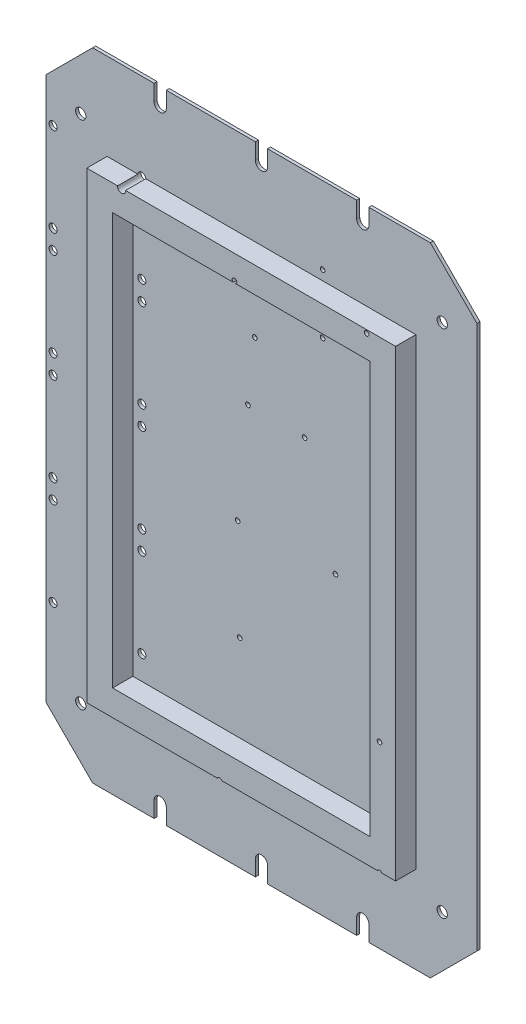
from build123d import *

# Parameters (mm, degrees)
BOSS_EXTRUDE1_DEPTH      = 0.75
BOSS_EXTRUDE1_DEPTH_BACK = 0.75
CUT_EXTRUDE1_DEPTH       = 190.772483022
LPATTERN1_COUNT          = 7
LPATTERN1_PITCH          = 50
MIRROR1_COPY_1_DEPTH     = 190.772483022
MIRROR1_COPY_2_DEPTH     = 190.772483022
MIRROR1_COPY_3_DEPTH     = 190.772483022
MIRROR1_COPY_4_DEPTH     = 190.772483022
MIRROR1_COPY_5_DEPTH     = 190.772483022
MIRROR1_COPY_6_DEPTH     = 190.772483022
SKETCH6_W                = 152.4
SKETCH6_H                = 228.6
SKETCH6_W_2              = 127
SKETCH6_H_2              = 203.2
BOSS_EXTRUDE2_DEPTH      = 11.5
SKETCH7_R                = 2.54
CUT_EXTRUDE2_DEPTH       = 191.11912795
CUT_EXTRUDE3_DEPTH       = 191.11912795
CUT_EXTRUDE3_DEPTH_BACK  = 191.11912795
SKETCH8_R                = 1.15
CUT_EXTRUDE4_DEPTH       = 191.11912795


with BuildPart() as part:
    # Sketch3 → Boss-Extrude1 (new, two sides: drawn at the far end of the back side and taken through both)
    with BuildSketch(Plane.XY.offset(-BOSS_EXTRUDE1_DEPTH_BACK)):
        Polygon((-106.3625, 134.1625), (-83.3625, 157.1625), (83.3625, 157.1625), (106.3625, 134.1625), (106.3625, -134.1625), (83.3625, -157.1625), (-83.3625, -157.1625), (-106.3625, -134.1625), align=None)
    extrude(amount=BOSS_EXTRUDE1_DEPTH + BOSS_EXTRUDE1_DEPTH_BACK)

    # Sketch4 → Cut-Extrude1 (cut, symmetric)
    with BuildSketch(Plane.XY):
        with BuildLine():
            Line((53, 149.225), (53, 157.1625))
            Line((53, 157.1625), (47, 157.1625))
            Line((47, 157.1625), (47, 149.225))
            ThreePointArc((47, 149.225), (50, 146.225), (53, 149.225))
        make_face()
    cut_extrude1 = extrude(amount=CUT_EXTRUDE1_DEPTH, both=True, mode=Mode.SUBTRACT)

    # LPattern1: Cut-Extrude1 ×7
    with Locations(*[(-i * LPATTERN1_PITCH, 0, 0) for i in range(1, LPATTERN1_COUNT)]):
        add(cut_extrude1, mode=Mode.SUBTRACT)

    # Mirror1: Cut-Extrude1 across plane
    add(cut_extrude1.mirror(Plane.ZX), mode=Mode.SUBTRACT)

    # Mirror1 copy 1 sketch → Mirror1 copy 1 (cut, symmetric)
    with BuildSketch(Plane(origin=(-50, 0, 0), x_dir=(1, 0, 0), z_dir=(0, 0, 1))):
        with BuildLine():
            Line((53, -149.225), (53, -157.1625))
            Line((53, -157.1625), (47, -157.1625))
            Line((47, -157.1625), (47, -149.225))
            ThreePointArc((47, -149.225), (50, -146.225), (53, -149.225))
        make_face()
    extrude(amount=MIRROR1_COPY_1_DEPTH, both=True, mode=Mode.SUBTRACT)

    # Mirror1 copy 2 sketch → Mirror1 copy 2 (cut, symmetric)
    with BuildSketch(Plane(origin=(-100, 0, 0), x_dir=(1, 0, 0), z_dir=(0, 0, 1))):
        with BuildLine():
            Line((53, -149.225), (53, -157.1625))
            Line((53, -157.1625), (47, -157.1625))
            Line((47, -157.1625), (47, -149.225))
            ThreePointArc((47, -149.225), (50, -146.225), (53, -149.225))
        make_face()
    extrude(amount=MIRROR1_COPY_2_DEPTH, both=True, mode=Mode.SUBTRACT)

    # Mirror1 copy 3 sketch → Mirror1 copy 3 (cut, symmetric)
    with BuildSketch(Plane(origin=(-150, 0, 0), x_dir=(1, 0, 0), z_dir=(0, 0, 1))):
        with BuildLine():
            Line((53, -149.225), (53, -157.1625))
            Line((53, -157.1625), (47, -157.1625))
            Line((47, -157.1625), (47, -149.225))
            ThreePointArc((47, -149.225), (50, -146.225), (53, -149.225))
        make_face()
    extrude(amount=MIRROR1_COPY_3_DEPTH, both=True, mode=Mode.SUBTRACT)

    # Mirror1 copy 4 sketch → Mirror1 copy 4 (cut, symmetric)
    with BuildSketch(Plane(origin=(-200, 0, 0), x_dir=(1, 0, 0), z_dir=(0, 0, 1))):
        with BuildLine():
            Line((53, -149.225), (53, -157.1625))
            Line((53, -157.1625), (47, -157.1625))
            Line((47, -157.1625), (47, -149.225))
            ThreePointArc((47, -149.225), (50, -146.225), (53, -149.225))
        make_face()
    extrude(amount=MIRROR1_COPY_4_DEPTH, both=True, mode=Mode.SUBTRACT)

    # Mirror1 copy 5 sketch → Mirror1 copy 5 (cut, symmetric)
    with BuildSketch(Plane(origin=(-250, 0, 0), x_dir=(1, 0, 0), z_dir=(0, 0, 1))):
        with BuildLine():
            Line((53, -149.225), (53, -157.1625))
            Line((53, -157.1625), (47, -157.1625))
            Line((47, -157.1625), (47, -149.225))
            ThreePointArc((47, -149.225), (50, -146.225), (53, -149.225))
        make_face()
    extrude(amount=MIRROR1_COPY_5_DEPTH, both=True, mode=Mode.SUBTRACT)

    # Mirror1 copy 6 sketch → Mirror1 copy 6 (cut, symmetric)
    with BuildSketch(Plane(origin=(-300, 0, 0), x_dir=(1, 0, 0), z_dir=(0, 0, 1))):
        with BuildLine():
            Line((53, -149.225), (53, -157.1625))
            Line((53, -157.1625), (47, -157.1625))
            Line((47, -157.1625), (47, -149.225))
            ThreePointArc((47, -149.225), (50, -146.225), (53, -149.225))
        make_face()
    extrude(amount=MIRROR1_COPY_6_DEPTH, both=True, mode=Mode.SUBTRACT)

    # Sketch6 → Boss-Extrude2 (add)
    with BuildSketch(Plane(origin=(0, 0, -0.75), x_dir=(-1, 0, 0), z_dir=(0, 0, -1))):
        Rectangle(SKETCH6_W, SKETCH6_H)
        Rectangle(SKETCH6_W_2, SKETCH6_H_2, mode=Mode.SUBTRACT)
    extrude(amount=-BOSS_EXTRUDE2_DEPTH)

    # Sketch7 → Cut-Extrude2 (cut, through all)
    with BuildSketch(Plane(origin=(0, 0, -0.75), x_dir=(-1, 0, 0), z_dir=(0, 0, -1))):
        with Locations((89.2175, 126.0475)):
            Circle(SKETCH7_R)
        with Locations((-89.2175, 126.0475)):
            Circle(SKETCH7_R)
        with Locations((-89.2175, -126.0475)):
            Circle(SKETCH7_R)
        with Locations((89.2175, -126.0475)):
            Circle(SKETCH7_R)
    extrude(amount=-CUT_EXTRUDE2_DEPTH, mode=Mode.SUBTRACT)

    # Sketch8 → Cut-Extrude3 (cut, two sides: drawn at the far end of the back side and taken through both)
    with BuildSketch(Plane(origin=(0, 0, -0.75), x_dir=(-1, 0, 0), z_dir=(0, 0, -1)).offset(-CUT_EXTRUDE3_DEPTH_BACK)):
        with Locations((-30.1625, 119.0625)):
            Circle(SKETCH8_R)
        with Locations((3.3375, 102.5625)):
            Circle(SKETCH8_R)
        with Locations((-30.1625, 89.8625)):
            Circle(SKETCH8_R)
        with Locations((3.3375, 73.3625)):
            Circle(SKETCH8_R)
        with Locations((-21.2725, 42.8625)):
            Circle(SKETCH8_R)
        with Locations((6.6675, 42.8625)):
            Circle(SKETCH8_R)
        with Locations((-36.5125, -7.9375)):
            Circle(SKETCH8_R)
        with Locations((11.7475, -9.2075)):
            Circle(SKETCH8_R)
        with Locations((-68.2625, -58.7375)):
            Circle(SKETCH8_R)
        with Locations((10.7375, -58.7375)):
            Circle(SKETCH8_R)
        with Locations((10.7375, -114.7375)):
            Circle(SKETCH8_R)
        with Locations((-68.2625, -114.7375)):
            Circle(SKETCH8_R)
        with Locations((-61.9125, 112.7125)):
            Circle(SKETCH8_R)
        with Locations((-61.9125, 33.7125)):
            Circle(SKETCH8_R)
    extrude(amount=CUT_EXTRUDE3_DEPTH + CUT_EXTRUDE3_DEPTH_BACK, mode=Mode.SUBTRACT)

    # Sketch10 → Cut-Extrude4 (cut, through all)
    with BuildSketch(Plane(origin=(0, 0, -0.75), x_dir=(-1, 0, 0), z_dir=(0, 0, -1))):
        with BuildLine():
            ThreePointArc((59.0677, -91.718), (61.0489, -89.7368), (59.0677, -87.7556))
            ThreePointArc((59.0677, -87.7556), (57.0865, -89.7368), (59.0677, -91.718))
        make_face()
        with BuildLine():
            ThreePointArc((59.0677, -38.378), (61.0489, -36.3968), (59.0677, -34.4156))
            ThreePointArc((59.0677, -34.4156), (57.0865, -36.3968), (59.0677, -38.378))
        make_face()
        with BuildLine():
            ThreePointArc((59.0677, -47.903), (61.0489, -45.9218), (59.0677, -43.9406))
            ThreePointArc((59.0677, -43.9406), (57.0865, -45.9218), (59.0677, -47.903))
        make_face()
        with BuildLine():
            ThreePointArc((59.0677, 5.437), (61.0489, 7.4182), (59.0677, 9.3994))
            ThreePointArc((59.0677, 9.3994), (57.0865, 7.4182), (59.0677, 5.437))
        make_face()
        with BuildLine():
            ThreePointArc((59.0677, 14.962), (61.0489, 16.9432), (59.0677, 18.9244))
            ThreePointArc((59.0677, 18.9244), (57.0865, 16.9432), (59.0677, 14.962))
        make_face()
        with BuildLine():
            ThreePointArc((59.0677, 58.777), (61.0489, 60.7582), (59.0677, 62.7394))
            ThreePointArc((59.0677, 62.7394), (57.0865, 60.7582), (59.0677, 58.777))
        make_face()
        with BuildLine():
            ThreePointArc((59.0677, 68.302), (61.0489, 70.2832), (59.0677, 72.2644))
            ThreePointArc((59.0677, 72.2644), (57.0865, 70.2832), (59.0677, 68.302))
        make_face()
        with BuildLine():
            ThreePointArc((59.0677, 112.117), (61.0489, 114.0982), (59.0677, 116.0794))
            ThreePointArc((59.0677, 116.0794), (57.0865, 114.0982), (59.0677, 112.117))
        make_face()
        with BuildLine():
            ThreePointArc((102.8827, 68.302), (104.8639, 70.2832), (102.8827, 72.2644))
            ThreePointArc((102.8827, 72.2644), (100.9015, 70.2832), (102.8827, 68.302))
        make_face()
        with BuildLine():
            ThreePointArc((102.8827, 112.117), (104.8639, 114.0982), (102.8827, 116.0794))
            ThreePointArc((102.8827, 116.0794), (100.9015, 114.0982), (102.8827, 112.117))
        make_face()
        with BuildLine():
            ThreePointArc((102.8827, 14.962), (104.8639, 16.9432), (102.8827, 18.9244))
            ThreePointArc((102.8827, 18.9244), (100.9015, 16.9432), (102.8827, 14.962))
        make_face()
        with BuildLine():
            ThreePointArc((102.8827, 58.777), (104.8639, 60.7582), (102.8827, 62.7394))
            ThreePointArc((102.8827, 62.7394), (100.9015, 60.7582), (102.8827, 58.777))
        make_face()
        with BuildLine():
            ThreePointArc((102.8827, -38.378), (104.8639, -36.3968), (102.8827, -34.4156))
            ThreePointArc((102.8827, -34.4156), (100.9015, -36.3968), (102.8827, -38.378))
        make_face()
        with BuildLine():
            ThreePointArc((102.8827, 5.437), (104.8639, 7.4182), (102.8827, 9.3994))
            ThreePointArc((102.8827, 9.3994), (100.9015, 7.4182), (102.8827, 5.437))
        make_face()
        with BuildLine():
            ThreePointArc((102.8827, -47.903), (104.8639, -45.9218), (102.8827, -43.9406))
            ThreePointArc((102.8827, -43.9406), (100.9015, -45.9218), (102.8827, -47.903))
        make_face()
        with BuildLine():
            ThreePointArc((102.8827, -91.718), (104.8639, -89.7368), (102.8827, -87.7556))
            ThreePointArc((102.8827, -87.7556), (100.9015, -89.7368), (102.8827, -91.718))
        make_face()
    extrude(amount=-CUT_EXTRUDE4_DEPTH, mode=Mode.SUBTRACT)


solid = part.part
